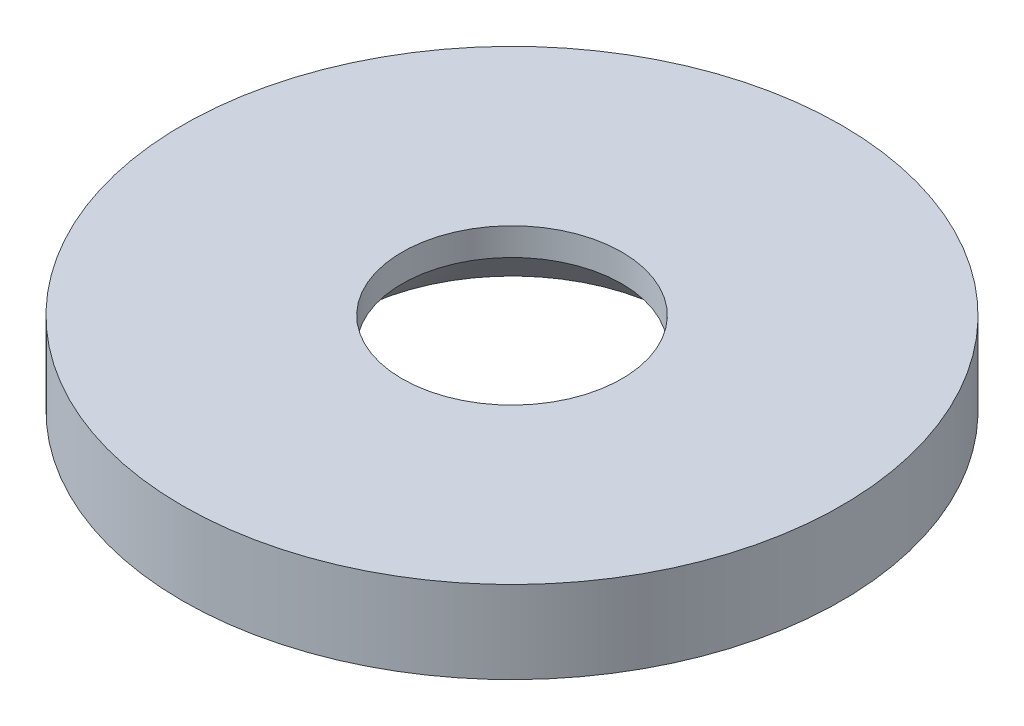
from build123d import *

# Parameters (mm, degrees)
SKETCH_1_R      = 6
SKETCH_1_R_2    = 2
EXTRUDE_1_DEPTH = 1.5
CHAMFER_1_SIZE  = 1


with BuildPart() as part:
    # Эскиз1 → Бобышка-Вытянуть1 (new body)
    with BuildSketch(Plane(origin=(0, 0, 0), x_dir=(1, 0, 0), z_dir=(0, 1, 0))):
        with Locations(Location((0, 0, 0), (0, 0, 270))):
            Circle(SKETCH_1_R)
        with Locations(Location((0, 0, 0), (0, 0, 270))):
            Circle(SKETCH_1_R_2, mode=Mode.SUBTRACT)
    extrude(amount=EXTRUDE_1_DEPTH)

    # Фаска1
    chamfer_1_edges = [part.edges().sort_by_distance(p)[0] for p in [
        (0, 0, -2),
    ]]
    chamfer(chamfer_1_edges, length=CHAMFER_1_SIZE)


solid = part.part
